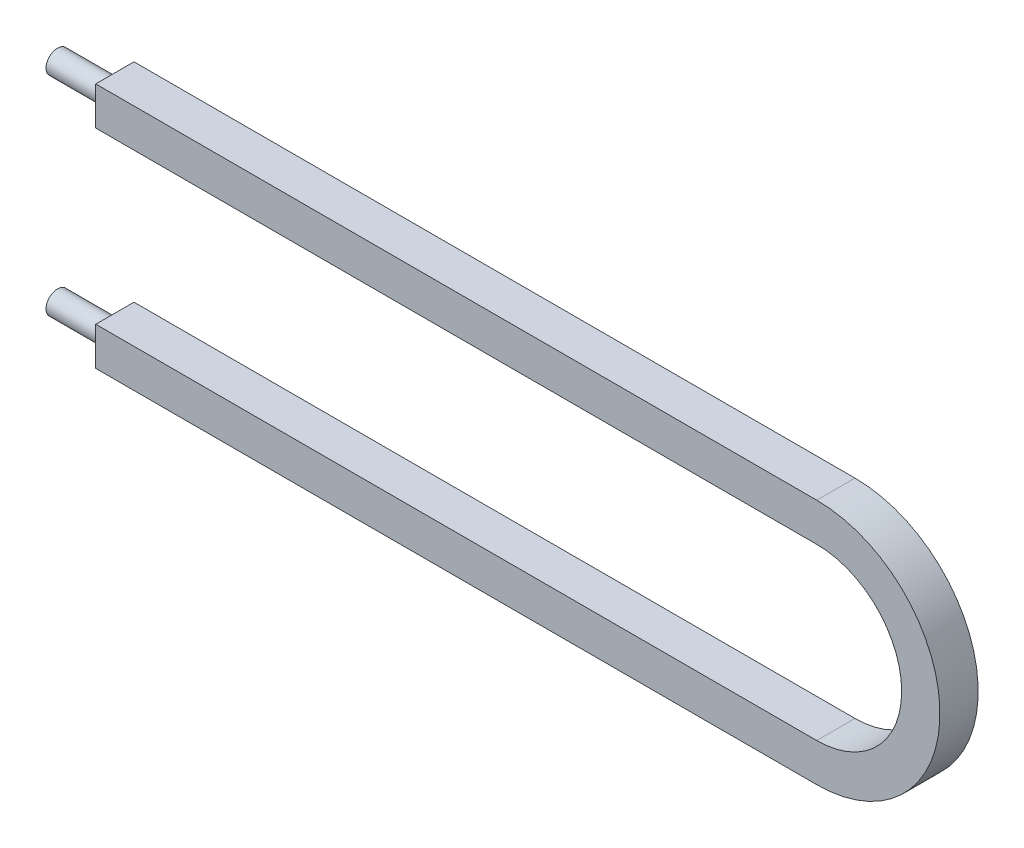
from build123d import *

# Parameters (mm, degrees)
BOSS_EXTRUDE1_DEPTH = 10
SKETCH2_R           = 3
BOSS_EXTRUDE2_DEPTH = 15
SKETCH3_R           = 3
BOSS_EXTRUDE3_DEPTH = 15


with BuildPart() as part:
    # Sketch1 → Boss-Extrude1 (new body)
    with BuildSketch(Plane.XY):
        with BuildLine():
            Line((0, 0), (188.467924539, 0))
            ThreePointArc((188.467924539, 0), (220.672766762, -32.204842223), (188.467924539, -64.409684446))
            Line((188.467924539, -64.409684446), (0, -64.409684446))
            Line((0, -64.409684446), (0, -54.409684446))
            Line((0, -54.409684446), (188.467924539, -54.409684446))
            ThreePointArc((188.467924539, -54.409684446), (210.672766762, -32.204842223), (188.467924539, -10))
            Line((188.467924539, -10), (0, -10))
            Line((0, -10), (0, 0))
        make_face()
    extrude(amount=BOSS_EXTRUDE1_DEPTH)

    # Sketch2 → Boss-Extrude2 (add)
    with BuildSketch(Plane.ZY):
        with Locations(Location((5, -4.906979909, 0), (0, 0, 180))):
            Circle(SKETCH2_R)
    extrude(amount=BOSS_EXTRUDE2_DEPTH)

    # Sketch3 → Boss-Extrude3 (add)
    with BuildSketch(Plane.ZY):
        with Locations(Location((5, -59.409684446, 0), (0, 0, 180))):
            Circle(SKETCH3_R)
    extrude(amount=BOSS_EXTRUDE3_DEPTH)


solid = part.part
